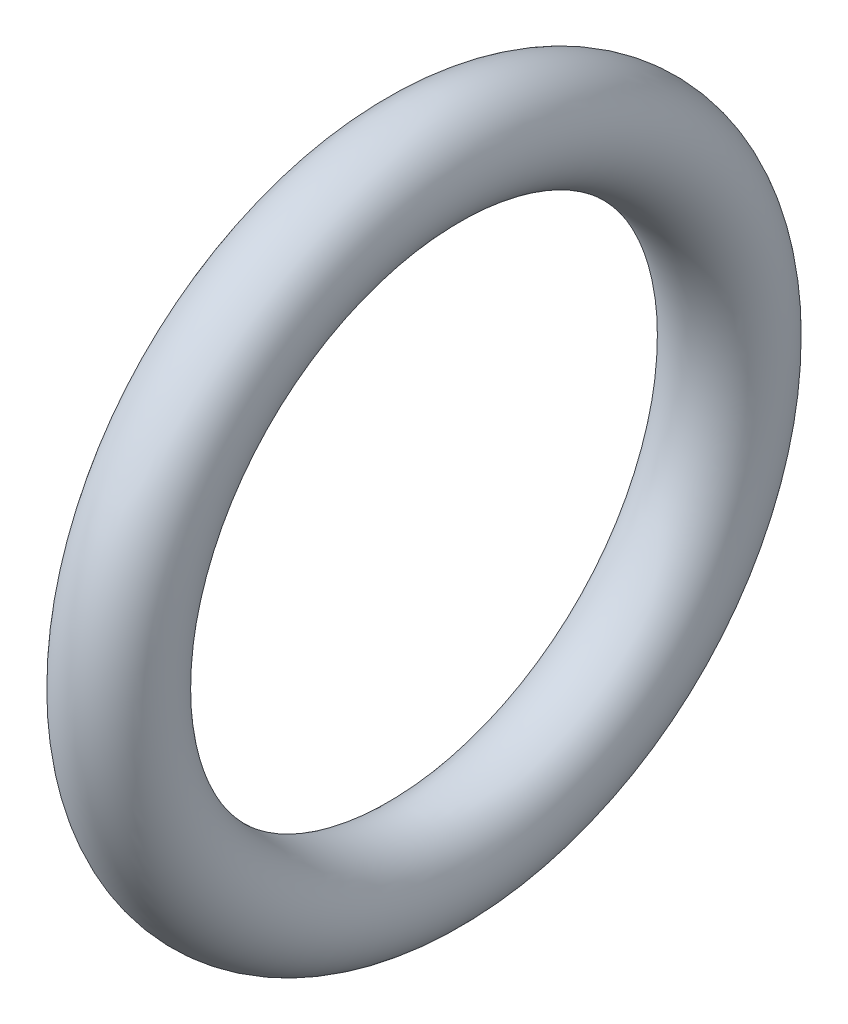
from build123d import *

# Parameters (mm, degrees)
SKETCH_1_R = 1.5


with BuildPart() as part:
    # Эскиз1 → Повернуть1 (revolve)
    with BuildSketch(Plane.XY, mode=Mode.PRIVATE) as revolve_1_sk:
        with Locations((0, 9)):
            Circle(SKETCH_1_R)
    revolve(revolve_1_sk.sketch.rotate(Axis((0, 0, 0), (1, 0, 0)), 90), axis=Axis((0, 0, 0), (1, 0, 0)))


solid = part.part
